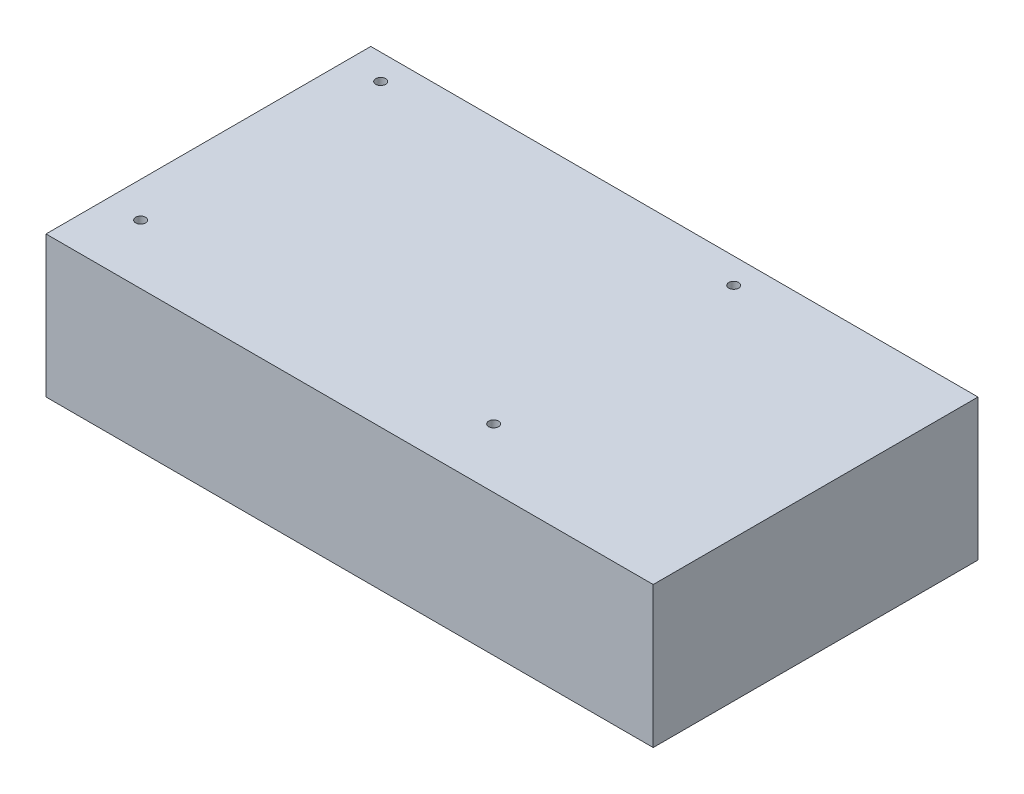
from build123d import *

# Parameters (mm, degrees)
SKETCH_1_W          = 215
SKETCH_1_H          = 115
EXTRUDE_1_DEPTH     = 50
SKETCH_3_R          = 1.75
CUT_EXTRUDE_1_DEPTH = 5


with BuildPart() as part:
    # 草图1 → 凸台-拉伸1 (new body)
    with BuildSketch(Plane(origin=(0, 0, 0), x_dir=(1, 0, 0), z_dir=(0, 1, 0))):
        with Locations((50.813539192, -6.686460808)):
            Rectangle(SKETCH_1_W, SKETCH_1_H)
    extrude(amount=EXTRUDE_1_DEPTH)

    # 草图3 → 切除-拉伸1 (cut)
    with BuildSketch(Plane(origin=(0, 50, 0), x_dir=(1, 0, 0), z_dir=(0, 1, 0))):
        with Locations(Location((-44.186460808, 41.813539192, 0), (0, 0, 270))):
            Circle(SKETCH_3_R)
        with Locations(Location((-44.186460808, -43.186460808, 0), (0, 0, 270))):
            Circle(SKETCH_3_R)
        with Locations(Location((80.813539192, -43.186460808, 0), (0, 0, 270))):
            Circle(SKETCH_3_R)
        with Locations(Location((80.813539192, 41.813539192, 0), (0, 0, 270))):
            Circle(SKETCH_3_R)
    extrude(amount=-CUT_EXTRUDE_1_DEPTH, mode=Mode.SUBTRACT)


solid = part.part
